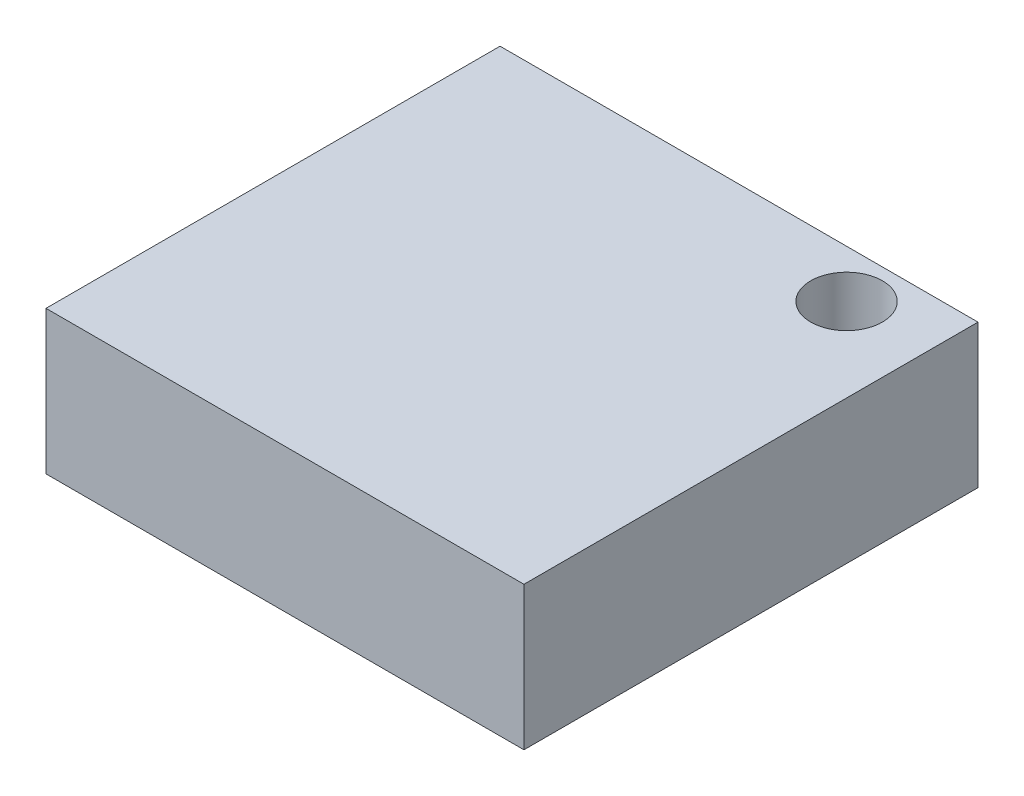
from build123d import *

# Parameters (mm, degrees)
ESQUISSE1_W             = 20
ESQUISSE1_H             = 19
BOSS_EXTRU_1_DEPTH      = 6
ESQUISSE2_R             = 1.5
ENL_V_MAT_EXTRU_1_DEPTH = 6


with BuildPart() as part:
    # Esquisse1 → Boss.-Extru.1 (new body)
    with BuildSketch(Plane(origin=(0, 0, 0), x_dir=(1, 0, 0), z_dir=(0, 1, 0))):
        with Locations((10, 9.5)):
            Rectangle(ESQUISSE1_W, ESQUISSE1_H)
    extrude(amount=BOSS_EXTRU_1_DEPTH)

    # Esquisse2 → Enlèv. mat.-Extru.1 (cut)
    with BuildSketch(Plane(origin=(0, 6, 0), x_dir=(1, 0, 0), z_dir=(0, 1, 0))):
        with Locations(Location((16.5, 17, 0), (0, 0, 270))):
            Circle(ESQUISSE2_R)
    extrude(amount=-ENL_V_MAT_EXTRU_1_DEPTH, mode=Mode.SUBTRACT)


solid = part.part
